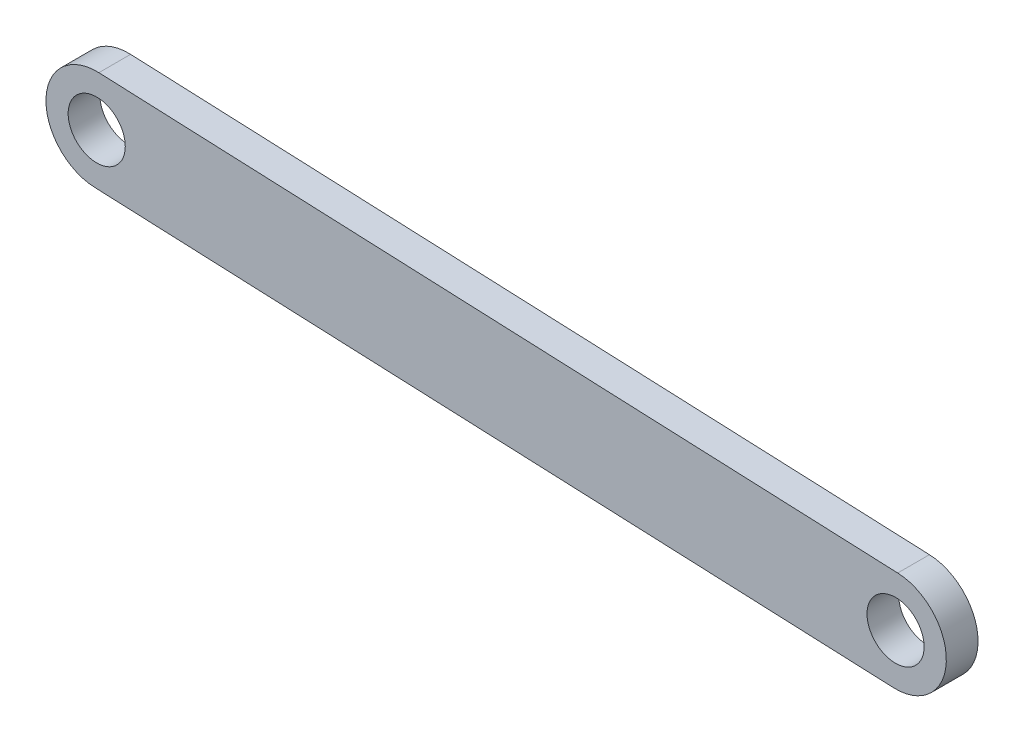
from build123d import *

# Parameters (mm, degrees)
SKETCH_1_R      = 4.5
EXTRUDE_1_DEPTH = 5


with BuildPart() as part:
    # 草图1 → 凸台-拉伸1 (new body)
    with BuildSketch(Plane.XY):
        with BuildLine():
            Line((151.317035713, 41.836054816), (277.203812492, 36.495696009))
            ThreePointArc((277.203812492, 36.495696009), (284.857553315, 28.163814384), (276.525671691, 20.510073561))
            Line((276.525671691, 20.510073561), (150.638894912, 25.850432368))
            ThreePointArc((150.638894912, 25.850432368), (142.985154088, 34.182313992), (151.317035713, 41.836054816))
        make_face()
        with Locations((150.977965312, 33.843243592)):
            Circle(SKETCH_1_R, mode=Mode.SUBTRACT)
        with Locations((276.864742091, 28.502884785)):
            Circle(SKETCH_1_R, mode=Mode.SUBTRACT)
    extrude(amount=EXTRUDE_1_DEPTH)


solid = part.part
